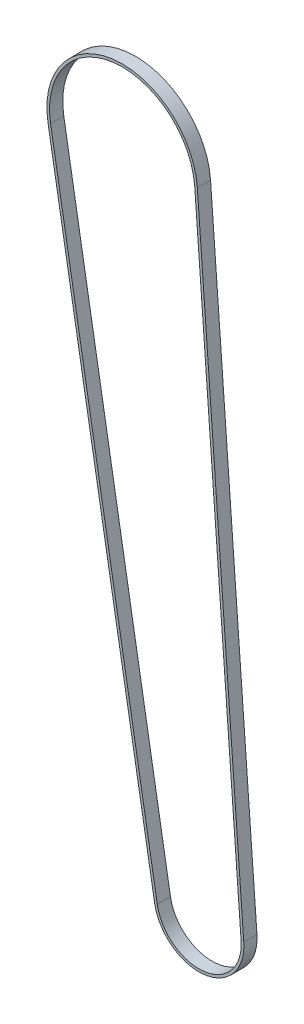
from build123d import *

# Parameters (mm, degrees)
BOSS_EXTRUDE1_DEPTH = 10


with BuildPart() as part:
    # Sketch1 → Boss-Extrude1 (new, symmetric)
    with BuildSketch(Plane.XY):
        with BuildLine():
            Line((113.692130056, 8.372548198), (183.901093268, -945.005848443))
            ThreePointArc((183.901093268, -945.005848443), (124.332609771, -1017.497944869), (49.061221028, -961.482533533))
            Line((49.061221028, -961.482533533), (-112.362949876, -19.250129746))
            ThreePointArc((-112.362949876, -19.250129746), (-13.827319487, 113.15831934), (113.692130056, 8.372548198))
        make_face()
        with BuildLine():
            Line((109.70293251, 8.078774577), (179.911895722, -945.299622064))
            ThreePointArc((179.911895722, -945.299622064), (123.847440666, -1013.527477524), (53.003780673, -960.807090384))
            Line((53.003780673, -960.807090384), (-108.420390231, -18.574686597))
            ThreePointArc((-108.420390231, -18.574686597), (-13.342150382, 109.187851995), (109.70293251, 8.078774577))
        make_face(mode=Mode.SUBTRACT)
    extrude(amount=BOSS_EXTRUDE1_DEPTH, both=True)


solid = part.part
